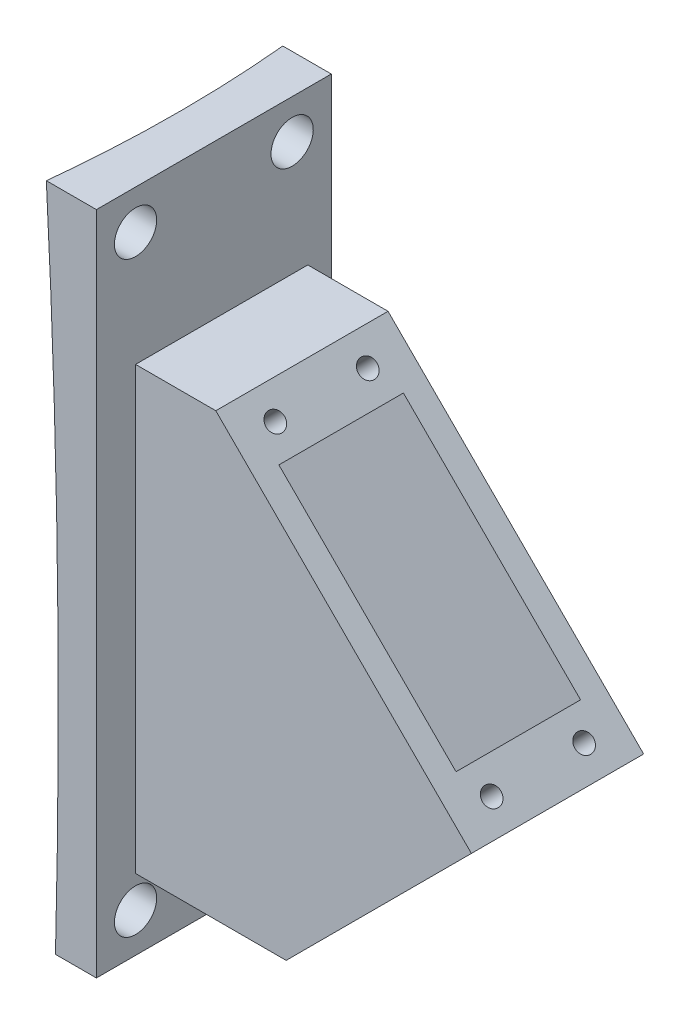
from build123d import *

# Parameters (mm, degrees)
SKETCH1_W               = 15.24
SKETCH1_H               = 47.25
BOSS_EXTRUDE1_DEPTH     = 29
BOSS_EXTRUDE2_DEPTH     = 15.24
BOSS_EXTRUDE3_START     = 6.35
BOSS_EXTRUDE3_DEPTH     = 27.94
CUT_EXTRUDE4_DEPTH      = 90.856122335
CUT_EXTRUDE4_DEPTH_BACK = 90.856122335
BOSS_EXTRUDE4_START     = 12.7
SKETCH15_W              = 12.73404056
SKETCH15_H              = 107.95
BOSS_EXTRUDE4_DEPTH     = 38.1
SKETCH17_R              = 3.429
CUT_EXTRUDE6_DEPTH      = 95.762638832
BOSS_EXTRUDE9_DEPTH     = 6.35
BOSS_EXTRUDE10_DEPTH    = 6.35
SKETCH12_W              = 20.20062
SKETCH12_H              = 40.64
CUT_EXTRUDE8_DEPTH      = 38.1
SKETCH21_W              = 27.94
SKETCH21_H              = 50.342193805
CUT_EXTRUDE9_DEPTH      = 8
SKETCH22_W              = 27.94
SKETCH22_H              = 8
CUT_EXTRUDE10_DEPTH     = 2.54
BOSS_EXTRUDE11_DEPTH    = 13.97
SKETCH24_W              = 11.491520074
SKETCH24_H              = 20.20062
CUT_EXTRUDE11_DEPTH     = 112.502999945
SKETCH25_R              = 1.5
CUT_EXTRUDE12_DEPTH     = 18


with BuildPart() as part:
    # Sketch1 → Boss-Extrude1 (new body)
    with BuildSketch(Plane(origin=(0, 0, 0), x_dir=(0, 0, -1), z_dir=(1, 0, 0))):
        Rectangle(SKETCH1_W, SKETCH1_H)
    extrude(amount=BOSS_EXTRUDE1_DEPTH)

    # Sketch8 → Cut-Revolve1 (revolve, cut)
    with BuildSketch(Plane(origin=(0, 0, 0), x_dir=(1, 0, 0), z_dir=(0, 1, 0))):
        with BuildLine():
            Line((-1363.98, 509.27), (-1363.98, -509.27))
            add(Edge.make_bspline(
                [(-1363.98, -509.27), (8.89, -509.27), (8.89, 0), (8.89, 509.27), (-1363.98, 509.27)],
                knots=[4.71238898, 4.71238898, 4.71238898, 6.283185307, 6.283185307, 7.853981634, 7.853981634, 7.853981634], degree=2, weights=[1, 0.707106781, 1, 0.707106781, 1]))
        make_face()
    revolve(axis=Axis((-1363.98, 0, -509.27), (0, 0, 1)), mode=Mode.SUBTRACT)

    # Sketch9 → Boss-Extrude2 (add)
    with BuildSketch(Plane.XY.offset(7.62)):
        Polygon((29, -23.625), (57.293684645, -23.625), (29, 23.625), align=None)
    extrude(amount=-BOSS_EXTRUDE2_DEPTH)

    # Sketch11 → Boss-Extrude3 (add)
    with BuildSketch(Plane(origin=(0, 0, -7.62), x_dir=(-1, 0, 0), z_dir=(0, 0, -1)).offset(BOSS_EXTRUDE3_START)):
        Polygon((-8.532999942, 23.625), (-35.473768305, 50.565768363), (-71.071074924, 14.968461744), (-48.544371121, -9.013786608), (-28.889356272, 23.625), align=None)
    extrude(amount=-BOSS_EXTRUDE3_DEPTH)

    # Sketch13 → Cut-Extrude4 (cut, two sides: drawn at the far end of the back side and taken through both)
    with BuildSketch(Plane(origin=(0, 0, -7.62), x_dir=(-1, 0, 0), z_dir=(0, 0, -1)).offset(-CUT_EXTRUDE4_DEPTH_BACK)):
        Polygon((-61.672265147, 5.569651967), (-8.532999942, -23.625), (-25.02523354, -53.6436889), (-79.417056311, -23.760883228), align=None)
    extrude(amount=CUT_EXTRUDE4_DEPTH + CUT_EXTRUDE4_DEPTH_BACK, mode=Mode.SUBTRACT)

    # Sketch15 → Boss-Extrude4 (add)
    with BuildSketch(Plane.XY.offset(7.62).offset(BOSS_EXTRUDE4_START)):
        with Locations((7.499979662, 18.790026662)):
            Rectangle(SKETCH15_W, SKETCH15_H)
    extrude(amount=-BOSS_EXTRUDE4_DEPTH)

    # Sketch16 → Cut-Revolve2 (revolve, cut)
    with BuildSketch(Plane(origin=(0, 0, 0), x_dir=(1, 0, 0), z_dir=(0, 1, 0))):
        with BuildLine():
            Line((-1364.099005706, 509.27), (-1364.099005706, -509.27))
            add(Edge.make_bspline(
                [(-1364.099005706, -509.27), (8.770994294, -509.27), (8.770994294, 0), (8.770994294, 509.27), (-1364.099005706, 509.27)],
                knots=[4.71238898, 4.71238898, 4.71238898, 6.283185307, 6.283185307, 7.853981634, 7.853981634, 7.853981634], degree=2, weights=[1, 0.707106781, 1, 0.707106781, 1]))
        make_face()
    revolve(axis=Axis((-1364.099005706, 0, -509.27), (0, 0, 1)), mode=Mode.SUBTRACT)

    # Sketch17 → Cut-Extrude6 (cut, through all)
    with BuildSketch(Plane(origin=(13.866999942, 0, 0), x_dir=(0, 0, -1), z_dir=(1, 0, 0))):
        with Locations(Location((-13.97, -28.834973338, 0), (0, 0, 90))):
            Circle(SKETCH17_R)
        with Locations(Location((-13.97, 66.415026662, 0), (0, 0, 90))):
            Circle(SKETCH17_R)
        with Locations(Location((11.43, 66.415026662, 0), (0, 0, 90))):
            Circle(SKETCH17_R)
        with Locations(Location((11.43, -28.834973338, 0), (0, 0, 90))):
            Circle(SKETCH17_R)
    extrude(amount=-CUT_EXTRUDE6_DEPTH, mode=Mode.SUBTRACT)

    # Sketch19 → Boss-Extrude9 (add)
    with BuildSketch(Plane.XY.offset(7.62)):
        Polygon((13.866999942, 23.625), (13.866999942, -20.694506456), (45.209055073, -3.475216955), (28.889356272, 23.625), align=None)
    extrude(amount=BOSS_EXTRUDE9_DEPTH)

    # Sketch20 → Boss-Extrude10 (add)
    with BuildSketch(Plane(origin=(0, 0, -7.62), x_dir=(-1, 0, 0), z_dir=(0, 0, -1))):
        Polygon((-45.209055073, -3.475216955), (-13.866999942, -20.694506456), (-13.866999942, 23.625), (-28.889356272, 23.625), align=None)
    extrude(amount=BOSS_EXTRUDE10_DEPTH)

    # Sketch12 → Cut-Extrude8 (cut)
    with BuildSketch(Plane(origin=(43.019768334, 43.019768334, 0), x_dir=(0, 0, -1), z_dir=(0.7071067811865476, 0.7071067811865476, 0))):
        with Locations((0, -14.49944132)):
            Rectangle(SKETCH12_W, SKETCH12_H)
    extrude(amount=-CUT_EXTRUDE8_DEPTH, mode=Mode.SUBTRACT)

    # Sketch21 → Cut-Extrude9 (cut)
    with BuildSketch(Plane(origin=(43.019768334, 43.019768334, 0), x_dir=(0, 0, -1), z_dir=(0.7071067811865477, 0.7071067811865475, 0))):
        with Locations((0, -14.49944132)):
            Rectangle(SKETCH21_W, SKETCH21_H)
    extrude(amount=-CUT_EXTRUDE9_DEPTH, mode=Mode.SUBTRACT)

    # Sketch22 → Cut-Extrude10 (cut)
    with BuildSketch(Plane(origin=(28.05130659, -28.05130659, 0), x_dir=(0, 0, 1), z_dir=(-0.7071067811865476, 0.7071067811865476, 0))):
        with Locations((0, 56.839139829)):
            Rectangle(SKETCH22_W, SKETCH22_H)
    extrude(amount=-CUT_EXTRUDE10_DEPTH, mode=Mode.SUBTRACT)

    # Sketch23 → Boss-Extrude11 (add, symmetric)
    with BuildSketch(Plane.XY):
        Polygon((29.816914056, 44.908914114), (26.883196541, 47.842631629), (13.866999942, 47.842631629), (13.866999942, 28.959), align=None)
        Polygon((65.591257632, 9.134570538), (13.866999942, -20.694506456), (13.866999942, -23.674292513), (38.295755697, -23.674292513), (68.34793819, 6.37788998), align=None)
    extrude(amount=BOSS_EXTRUDE11_DEPTH, both=True)

    # Sketch24 → Cut-Extrude11 (cut, through all)
    with BuildSketch(Plane(origin=(12.416727049, -21.530870355, 0), x_dir=(0.8662714122168664, 0.49957365860881403, 0), z_dir=(-0.49957365860881403, 0.8662714122168664, 0))):
        with Locations((35.963054904, 0)):
            Rectangle(SKETCH24_W, SKETCH24_H)
    extrude(amount=-CUT_EXTRUDE11_DEPTH, mode=Mode.SUBTRACT)

    # Sketch25 → Cut-Extrude12 (cut)
    with BuildSketch(Plane(origin=(37.362914085, 37.362914085, 0), x_dir=(0, 0, -1), z_dir=(0.7071067811865476, 0.7071067811865475, 0))):
        with Locations(Location((-7.5, 10.32055868, 0), (0, 0, 90))):
            Circle(SKETCH25_R)
        with Locations(Location((7.5, 10.32055868, 0), (0, 0, 90))):
            Circle(SKETCH25_R)
        with Locations(Location((-7.5, -39.31944132, 0), (0, 0, 90))):
            Circle(SKETCH25_R)
        with Locations(Location((7.5, -39.31944132, 0), (0, 0, 90))):
            Circle(SKETCH25_R)
    extrude(amount=-CUT_EXTRUDE12_DEPTH, mode=Mode.SUBTRACT)


solid = part.part
